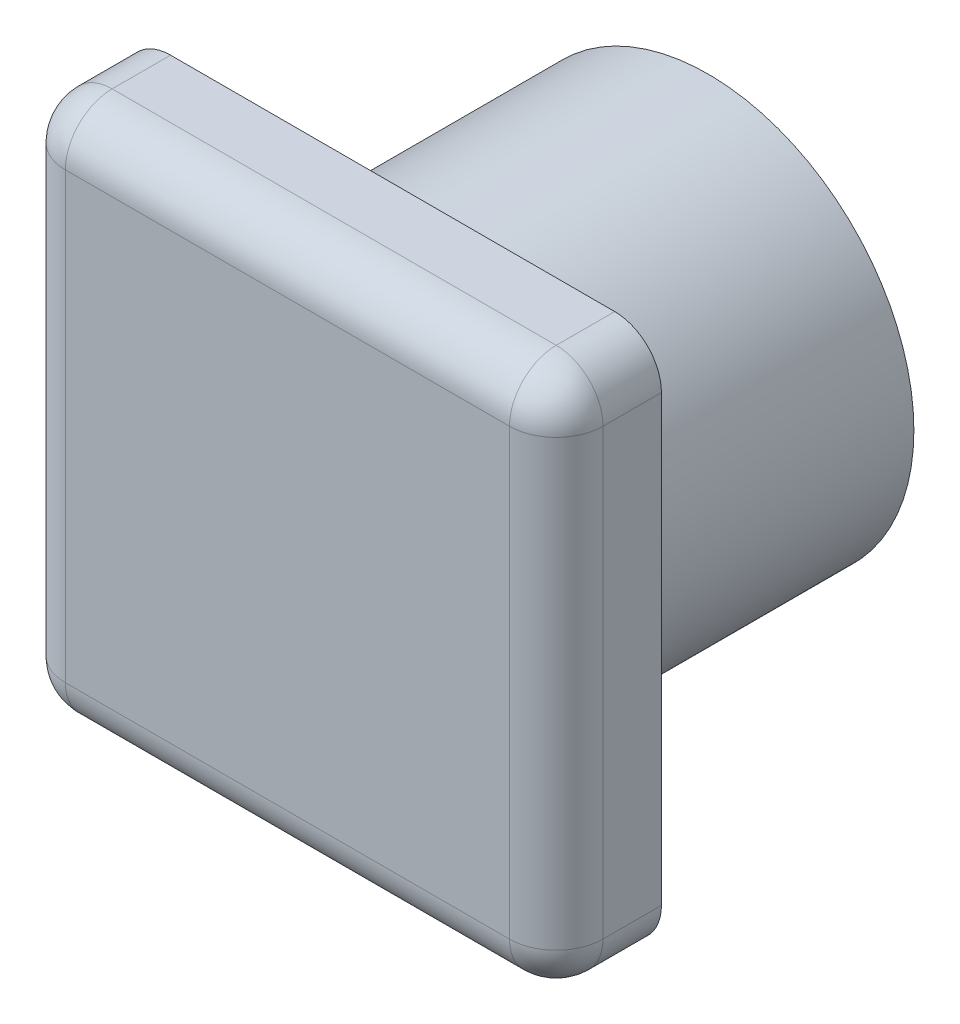
from build123d import *

# Parameters (mm, degrees)
SKETCH3_R           = 8.8
BOSS_EXTRUDE1_DEPTH = 13.5
SKETCH4_W           = 23
SKETCH4_H           = 23
BOSS_EXTRUDE2_DEPTH = 4.5
FILLET1_R           = 2


with BuildPart() as part:
    # Sketch3 → Boss-Extrude1 (new body)
    with BuildSketch(Plane.XY):
        Circle(SKETCH3_R)
    extrude(amount=BOSS_EXTRUDE1_DEPTH)

    # Sketch4 → Boss-Extrude2 (add)
    with BuildSketch(Plane.XY.offset(13.5)):
        Rectangle(SKETCH4_W, SKETCH4_H)
    extrude(amount=BOSS_EXTRUDE2_DEPTH)

    # Fillet1
    fillet1_edges = [part.edges().sort_by_distance(p)[0] for p in [
        (11.5, -11.5, 15.75),
        (11.5, 11.5, 15.75),
        (-11.5, 11.5, 15.75),
        (-11.5, -11.5, 15.75),
        (11.5, 0, 18),
        (0, 11.5, 18),
        (-11.5, 0, 18),
        (0, -11.5, 18),
    ]]
    fillet(fillet1_edges, radius=FILLET1_R)


solid = part.part
